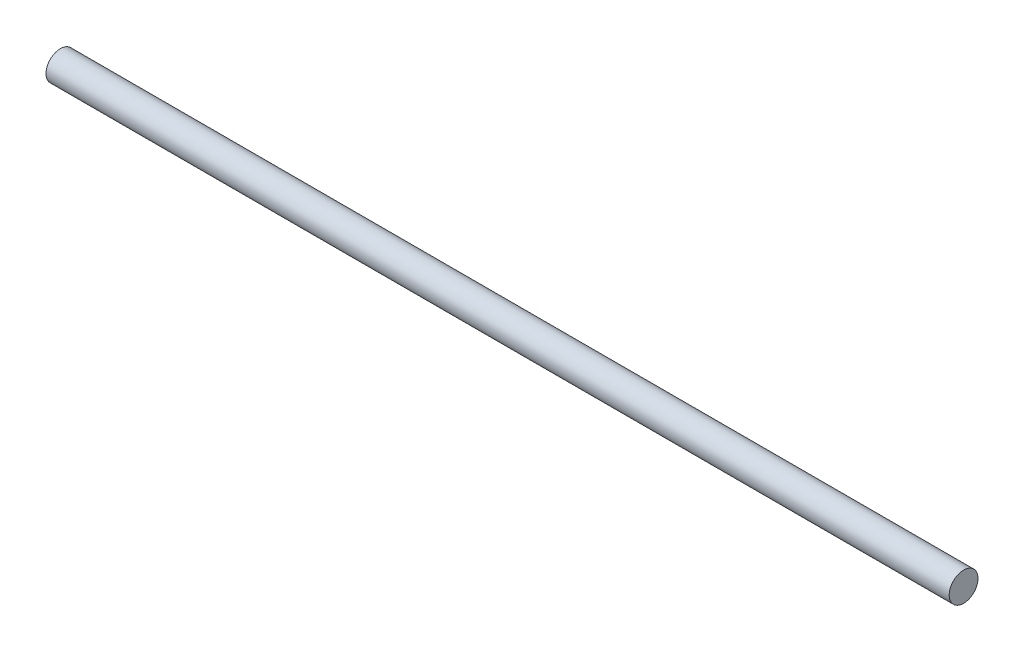
from build123d import *

# Parameters (mm, degrees)
SKETCH1_W = 407
SKETCH1_H = 6.5


with BuildPart() as part:
    # Sketch1 → Revolve1 (revolve)
    with BuildSketch(Plane(origin=(0, 0, 0), x_dir=(1, 0, 0), z_dir=(0, 1, 0)), mode=Mode.PRIVATE) as revolve1_sk:
        with Locations((203.5, 3.25)):
            Rectangle(SKETCH1_W, SKETCH1_H)
    revolve(revolve1_sk.sketch.rotate(Axis((0, 0, 0), (1, 0, 0)), 180), axis=Axis((0, 0, 0), (1, 0, 0)))


solid = part.part
